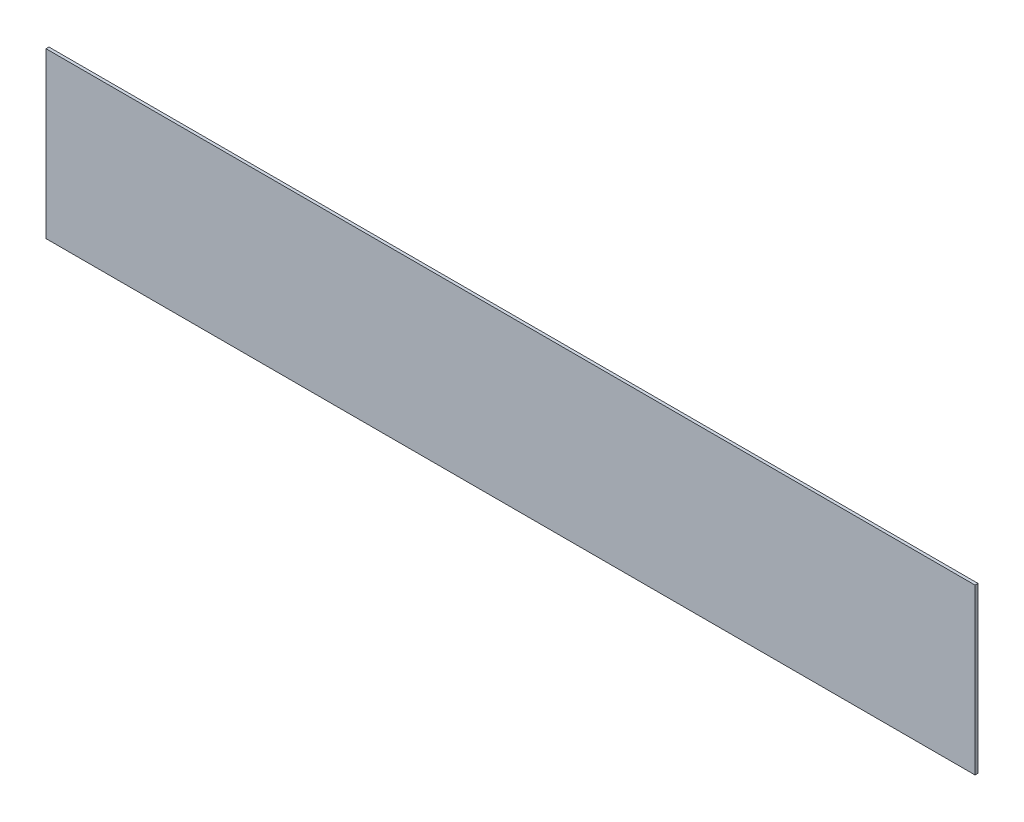
from build123d import *

# Parameters (mm, degrees)
SKETCH1_W           = 1000
SKETCH1_H           = 177.038
BOSS_EXTRUDE1_DEPTH = 3.175


with BuildPart() as part:
    # Sketch1 → Boss-Extrude1 (new body)
    with BuildSketch(Plane.XY):
        with Locations((500, -88.519)):
            Rectangle(SKETCH1_W, SKETCH1_H)
    extrude(amount=BOSS_EXTRUDE1_DEPTH)


solid = part.part
